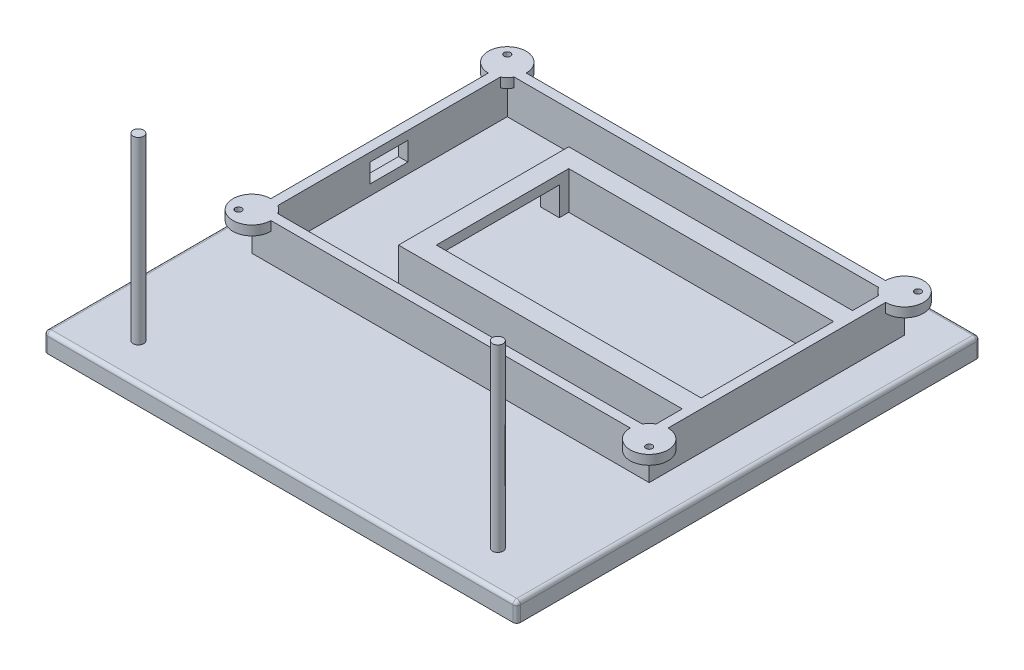
from build123d import *

# Parameters (mm, degrees)
SKETCH1_W           = 200
SKETCH1_H           = 125
BOSS_EXTRUDE3_DEPTH = 40
BOSS_EXTRUDE4_DEPTH = 10
EXTRUDE_THIN1_DEPTH = 40
SKETCH5_W           = 30
SKETCH5_H           = 15
CUT_EXTRUDE2_DEPTH  = 40
SKETCH6_W           = 210
SKETCH6_H           = 135
CUT_EXTRUDE3_DEPTH  = 20
SKETCH7_R           = 10
BOSS_EXTRUDE5_DEPTH = 5
SKETCH8_R           = 1.7
CUT_EXTRUDE5_DEPTH  = 5
SKETCH9_W           = 10
SKETCH9_H           = 5
CUT_EXTRUDE6_DEPTH  = 10
SKETCH10_W          = 230
SKETCH10_H          = 155
BOSS_EXTRUDE6_DEPTH = 10
SKETCH14_R          = 2.8
BOSS_EXTRUDE7_DEPTH = 95
FILLET1_R           = 2


with BuildPart() as part:
    # Sketch1 → Boss-Extrude3 (new body)
    with BuildSketch(Plane(origin=(0, 0, 0), x_dir=(1, 0, 0), z_dir=(0, 1, 0))):
        Polygon((5, 0), (0, 0), (0, -135), (210, -135), (210, 0), align=None)
        with Locations((105, -67.5)):
            Rectangle(SKETCH1_W, SKETCH1_H, mode=Mode.SUBTRACT)
    extrude(amount=BOSS_EXTRUDE3_DEPTH)

    # Sketch3 → Boss-Extrude4 (add)
    with BuildSketch(Plane(origin=(0, 0, 0), x_dir=(-1, 0, 0), z_dir=(0, -1, 0))):
        Polygon((-220, -145), (0, -145), (10, -145), (10, 10), (-220, 10), align=None)
    extrude(amount=BOSS_EXTRUDE4_DEPTH)

    # Sketch4 → Extrude-Thin1 (add)
    with BuildSketch(Plane(origin=(0, 0, 0), x_dir=(1, 0, 0), z_dir=(0, 1, 0))):
        Polygon((205, -32.5), (65, -32.5), (65, -102.5), (205, -102.5), (205, -112.5), (55, -112.5), (55, -22.5), (205, -22.5), align=None)
    extrude(amount=EXTRUDE_THIN1_DEPTH)

    # Sketch5 → Cut-Extrude2 (cut)
    with BuildSketch(Plane.ZY.offset(-55)):
        with Locations((82.5, 7.5)):
            Rectangle(SKETCH5_W, SKETCH5_H)
        with Locations((52.5, 7.5)):
            Rectangle(SKETCH5_W, SKETCH5_H)
    extrude(amount=-CUT_EXTRUDE2_DEPTH, mode=Mode.SUBTRACT)

    # Sketch6 → Cut-Extrude3 (cut)
    with BuildSketch(Plane(origin=(0, 40, 0), x_dir=(1, 0, 0), z_dir=(0, 1, 0))):
        with Locations((105, -67.5)):
            Rectangle(SKETCH6_W, SKETCH6_H)
    extrude(amount=-CUT_EXTRUDE3_DEPTH, mode=Mode.SUBTRACT)

    # Sketch7 → Boss-Extrude5 (add)
    with BuildSketch(Plane(origin=(0, 20, 0), x_dir=(1, 0, 0), z_dir=(0, 1, 0))):
        Circle(SKETCH7_R)
        with Locations((210, 0)):
            Circle(SKETCH7_R)
        with Locations((210, -135)):
            Circle(SKETCH7_R)
        with Locations((0, -135)):
            Circle(SKETCH7_R)
    extrude(amount=-BOSS_EXTRUDE5_DEPTH)

    # Sketch8 → Cut-Extrude5 (cut)
    with BuildSketch(Plane(origin=(0, 20, 0), x_dir=(1, 0, 0), z_dir=(0, 1, 0))):
        with Locations(Location((-3.535533906, 3.535533906, 0), (0, 0, 270))):
            Circle(SKETCH8_R)
        with Locations(Location((213.535533906, 3.535533906, 0), (0, 0, 270))):
            Circle(SKETCH8_R)
        with Locations(Location((213.535533906, -138.535533906, 0), (0, 0, 270))):
            Circle(SKETCH8_R)
        with Locations(Location((-3.535533906, -138.535533906, 0), (0, 0, 270))):
            Circle(SKETCH8_R)
    extrude(amount=-CUT_EXTRUDE5_DEPTH, mode=Mode.SUBTRACT)

    # Sketch9 → Cut-Extrude6 (cut)
    with BuildSketch(Plane.ZY):
        Polygon((77.5, 15.5), (77.5, 10.5), (67.5, 10.5), (57.5, 10.5), (57.5, 15.5), align=None)
        with Locations((72.5, 8)):
            Rectangle(SKETCH9_W, SKETCH9_H)
        with Locations((62.5, 8)):
            Rectangle(SKETCH9_W, SKETCH9_H)
    extrude(amount=-CUT_EXTRUDE6_DEPTH, mode=Mode.SUBTRACT)

    # Sketch10 → Boss-Extrude6 (add)
    with BuildSketch(Plane(origin=(0, 0, 0), x_dir=(1, 0, 0), z_dir=(0, 1, 0))):
        Polygon((230, 20), (-10, 20), (-20, 20), (-20, -225), (230, -225), align=None)
        with Locations((105, -67.5)):
            Rectangle(SKETCH10_W, SKETCH10_H, mode=Mode.SUBTRACT)
    extrude(amount=-BOSS_EXTRUDE6_DEPTH)

    # Sketch14 → Boss-Extrude7 (add)
    with BuildSketch(Plane(origin=(0, 0, 0), x_dir=(1, 0, 0), z_dir=(0, 1, 0))):
        with Locations(Location((10, -205, 0), (0, 0, 90))):
            Circle(SKETCH14_R)
        with Locations(Location((200, -205, 0), (0, 0, 90))):
            Circle(SKETCH14_R)
    extrude(amount=BOSS_EXTRUDE7_DEPTH)

    # Fillet1
    fillet1_edges = [part.edges().sort_by_distance(p)[0] for p in [
        (230, 0, 102.5),
        (230, -5, -20),
        (105, 0, 225),
        (230, -5, 225),
        (-20, 0, 102.5),
        (-20, -5, 225),
        (105, 0, -20),
        (-20, -5, -20),
    ]]
    fillet(fillet1_edges, radius=FILLET1_R)


solid = part.part
